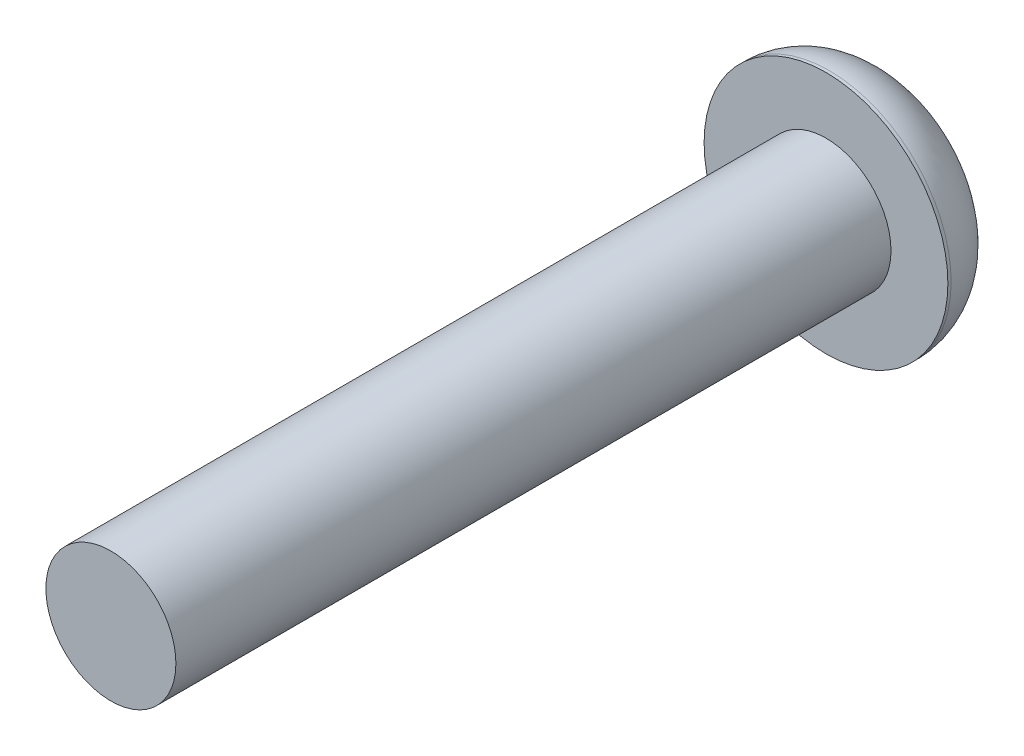
from build123d import *

# Parameters (mm, degrees)
SKETCH_1_R      = 2
EXTRUDE_1_DEPTH = 22
SKETCH_2_R      = 3.75
EXTRUDE_2_DEPTH = 2.1
FILLET_1_R      = 2


with BuildPart() as part:
    # 草图1 → 凸台-拉伸1 (new body)
    with BuildSketch(Plane.XY):
        Circle(SKETCH_1_R)
    extrude(amount=EXTRUDE_1_DEPTH)

    # 草图2 → 凸台-拉伸2 (add)
    with BuildSketch(Plane(origin=(0, 0, 0), x_dir=(-1, 0, 0), z_dir=(0, 0, -1))):
        Circle(SKETCH_2_R)
    extrude(amount=EXTRUDE_2_DEPTH)

    # 圆角1
    fillet_1_edges = [part.edges().sort_by_distance(p)[0] for p in [
        (3.75, 0, -2.1),
    ]]
    fillet(fillet_1_edges, radius=FILLET_1_R)


solid = part.part
